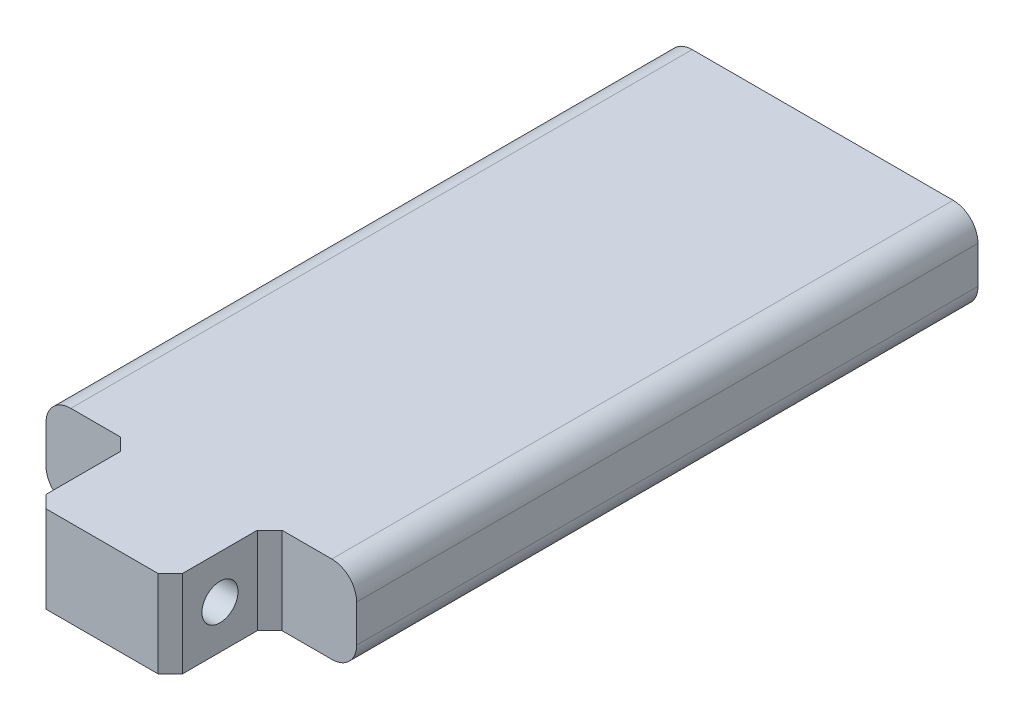
from build123d import *

# Parameters (mm, degrees)
SKETCH1_W                 = 25
SKETCH1_H                 = 7
BOSS_EXTRUDE1_DEPTH       = 58
SKETCH2_W                 = 7
SKETCH2_H                 = 8
CUT_EXTRUDE1_DEPTH        = 60.74320045
M3X0_5_TAPPED_HOLE2_D     = 2.5
M3X0_5_TAPPED_HOLE2_DEPTH = 7.5
M3X0_5_TAPPED_HOLE2_TIP   = 0.751075774
CHAMFER1_SIZE             = 1
M2_5_CLEARANCE_HOLE1_D    = 2.9
FILLET1_R                 = 2
CHAMFER2_SIZE             = 1


with BuildPart() as part:
    # Sketch1 → Boss-Extrude1 (new body)
    with BuildSketch(Plane.XY):
        Rectangle(SKETCH1_W, SKETCH1_H)
    extrude(amount=BOSS_EXTRUDE1_DEPTH)

    # Sketch2 → Cut-Extrude1 (cut, through all)
    with BuildSketch(Plane(origin=(0, 3.5, 0), x_dir=(1, 0, 0), z_dir=(0, 1, 0))):
        with Locations((-9, -54)):
            Rectangle(SKETCH2_W, SKETCH2_H)
        with Locations((9, -54)):
            Rectangle(SKETCH2_W, SKETCH2_H)
    extrude(amount=-CUT_EXTRUDE1_DEPTH, mode=Mode.SUBTRACT)

    # M3x0.5 Tapped Hole2
    with Locations(Plane(origin=(0, 0, 0), x_dir=(-1, 0, 0), z_dir=(0, 0, -1))):
        with Locations((-7, 0), (7, 0)):
            Hole(M3X0_5_TAPPED_HOLE2_D / 2, depth=M3X0_5_TAPPED_HOLE2_DEPTH)
            with Locations((0, 0, -(M3X0_5_TAPPED_HOLE2_DEPTH + M3X0_5_TAPPED_HOLE2_TIP / 2))):  # 118° drill point
                Cone(0, M3X0_5_TAPPED_HOLE2_D / 2, M3X0_5_TAPPED_HOLE2_TIP, mode=Mode.SUBTRACT)

    # Chamfer1
    chamfer1_edges = [part.edges().sort_by_distance(p)[0] for p in [
        (-5.5, 0, 58),
        (5.5, 0, 58),
    ]]
    chamfer(chamfer1_edges, length=CHAMFER1_SIZE)

    # M2.5 Clearance Hole1 (through all)
    with Locations(Plane(origin=(-5.5, -6.575007997, -1.706532938), x_dir=(0, 0, 1), z_dir=(-1, 0, 0))):
        with Locations((55.706532938, 6.575007997)):
            Hole(M2_5_CLEARANCE_HOLE1_D / 2)

    # Fillet1
    fillet1_edges = [part.edges().sort_by_distance(p)[0] for p in [
        (-12.5, -3.5, 25),
        (-12.5, 3.5, 25),
        (12.5, -3.5, 25),
        (12.5, 3.5, 25),
    ]]
    fillet(fillet1_edges, radius=FILLET1_R)

    # Chamfer2
    chamfer2_edges = [part.edges().sort_by_distance(p)[0] for p in [
        (-5.5, 0, 50),
        (5.5, 0, 50),
    ]]
    chamfer(chamfer2_edges, length=CHAMFER2_SIZE)


solid = part.part
